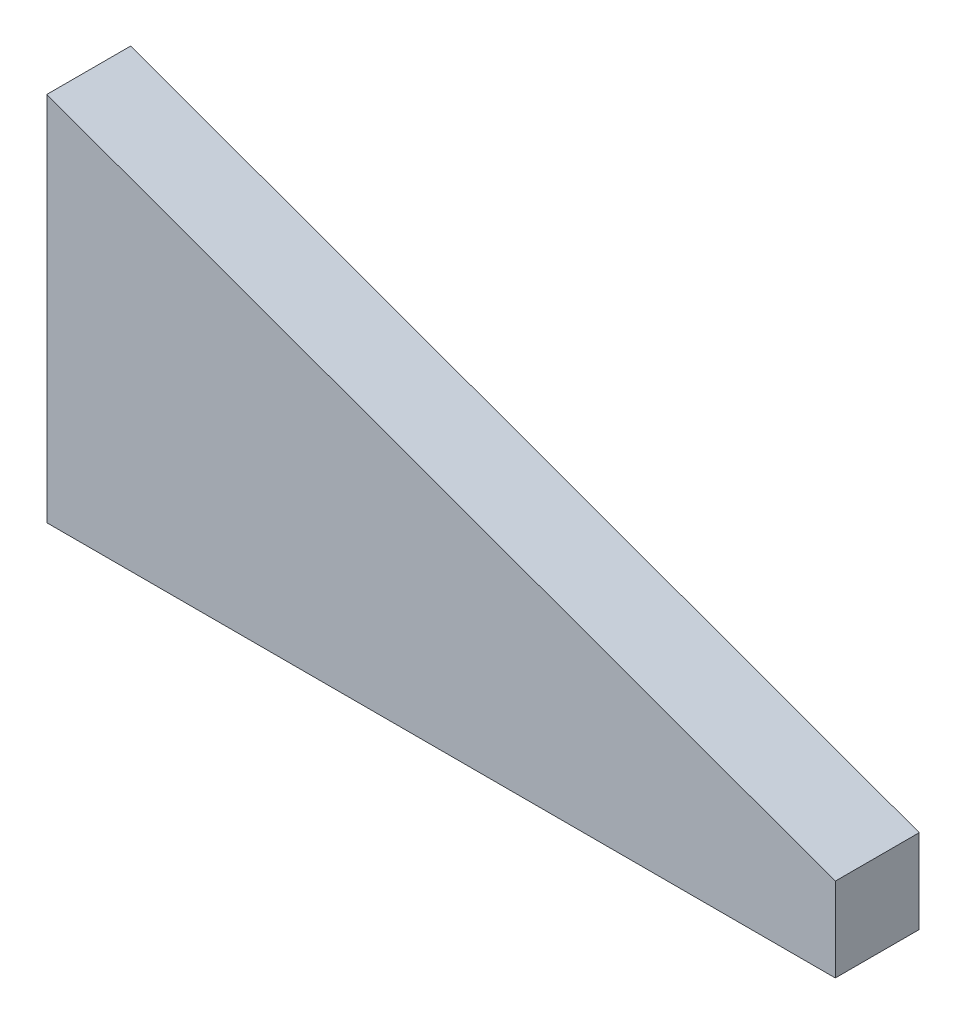
from build123d import *

# Parameters (mm, degrees)
BOSS_EXTRU_1_DEPTH = 5


with BuildPart() as part:
    # Esquisse1 → Boss.-Extru.1 (new body)
    with BuildSketch(Plane.XY):
        Polygon((-54.361055156, -21.029863319), (-101.345686196, -3.928856153), (-101.345686196, -21.029863319), (-101.345686196, -26.029863319), (-54.361055156, -26.029863319), align=None)
    extrude(amount=BOSS_EXTRU_1_DEPTH)


solid = part.part
